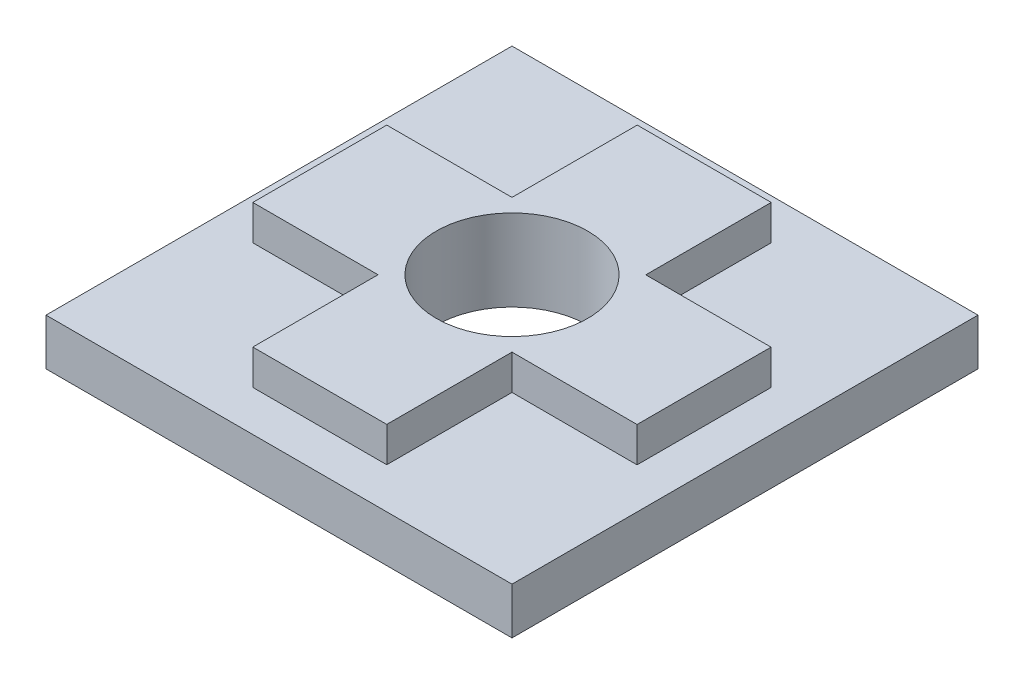
from build123d import *

# Parameters (mm, degrees)
SKETCH1_W                      = 20
SKETCH1_H                      = 20
BOSS_EXTRUDE1_DEPTH            = 2
BOSS_EXTRUDE3_DEPTH            = 1.5
TAP_DRILL_FOR_M2_2_HELICOIL1_D = 6.5


with BuildPart() as part:
    # Sketch1 → Boss-Extrude1 (new body)
    with BuildSketch(Plane(origin=(0, 0, 0), x_dir=(1, 0, 0), z_dir=(0, 1, 0))):
        Rectangle(SKETCH1_W, SKETCH1_H)
    extrude(amount=BOSS_EXTRUDE1_DEPTH)

    # Sketch3 → Boss-Extrude3 (add)
    with BuildSketch(Plane(origin=(0, 2, 0), x_dir=(1, 0, 0), z_dir=(0, 1, 0))):
        Polygon((-2.875, 8.25), (2.875, 8.25), (2.875, 2.867474963), (8.25, 2.867474963), (8.25, -2.882525037), (2.875, -2.875), (2.875, -8.25), (-2.875, -8.25), (-2.875, -2.875), (-8.25, -2.875), (-8.25, 2.875), (-2.875, 2.875), align=None)
    extrude(amount=BOSS_EXTRUDE3_DEPTH)

    # Tap Drill for M2.2 Helicoil1 (through all)
    with Locations(Plane.ZX.offset(3.5)):
        with Locations((0, 0)):
            Hole(TAP_DRILL_FOR_M2_2_HELICOIL1_D / 2)


solid = part.part
